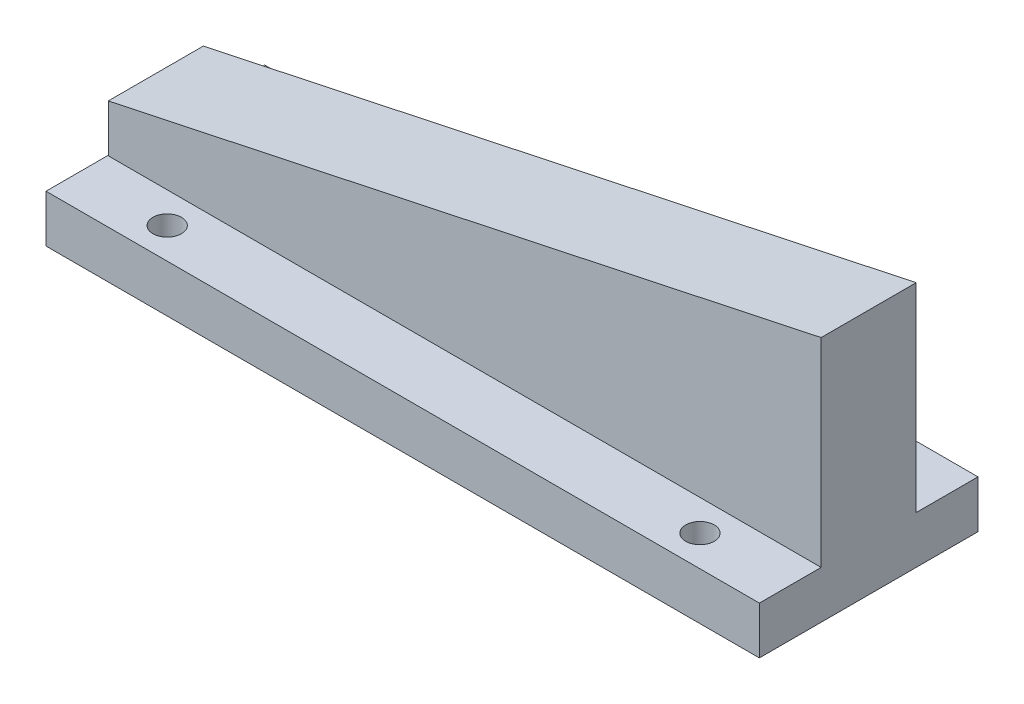
from build123d import *

# Parameters (mm, degrees)
SKETCH1_W           = 150
SKETCH1_H           = 20
BOSS_EXTRUDE1_DEPTH = 10
BOSS_EXTRUDE2_DEPTH = 10
SKETCH7_W           = 150.099930891
SKETCH7_H           = 10
BOSS_EXTRUDE3_DEPTH = 23
SKETCH8_R           = 3
CUT_EXTRUDE4_DEPTH  = 46


with BuildPart() as part:
    # Sketch1 → Boss-Extrude1 (new, symmetric)
    with BuildSketch(Plane(origin=(0, 0, 0), x_dir=(1, 0, 0), z_dir=(0, 1, 0))):
        Rectangle(SKETCH1_W, SKETCH1_H)
    extrude(amount=BOSS_EXTRUDE1_DEPTH, both=True)

    # Sketch2 → Boss-Extrude2 (add, symmetric)
    with BuildSketch(Plane.XY):
        Polygon((-75, 10), (75, 10), (75, 41.883484251), align=None)
    extrude(amount=BOSS_EXTRUDE2_DEPTH, both=True)

    # Sketch7 → Boss-Extrude3 (add, symmetric)
    with BuildSketch(Plane.XY):
        with Locations((-0.049965445, -5)):
            Rectangle(SKETCH7_W, SKETCH7_H)
    extrude(amount=BOSS_EXTRUDE3_DEPTH, both=True)

    # Sketch8 → Cut-Extrude4 (cut)
    with BuildSketch(Plane(origin=(0, 0, 10), x_dir=(1, 0, 0), z_dir=(0, 1, 0))):
        with Locations(Location((-56.099930891, 26.5, 0), (0, 0, 180))):
            Circle(SKETCH8_R)
        with Locations(Location((56, 26.5, 0), (0, 0, 180))):
            Circle(SKETCH8_R)
        with Locations(Location((56, -6.5, 0), (0, 0, 180))):
            Circle(SKETCH8_R)
        with Locations(Location((-56.099930891, -6.5, 0), (0, 0, 180))):
            Circle(SKETCH8_R)
    extrude(amount=-CUT_EXTRUDE4_DEPTH, mode=Mode.SUBTRACT)


solid = part.part
